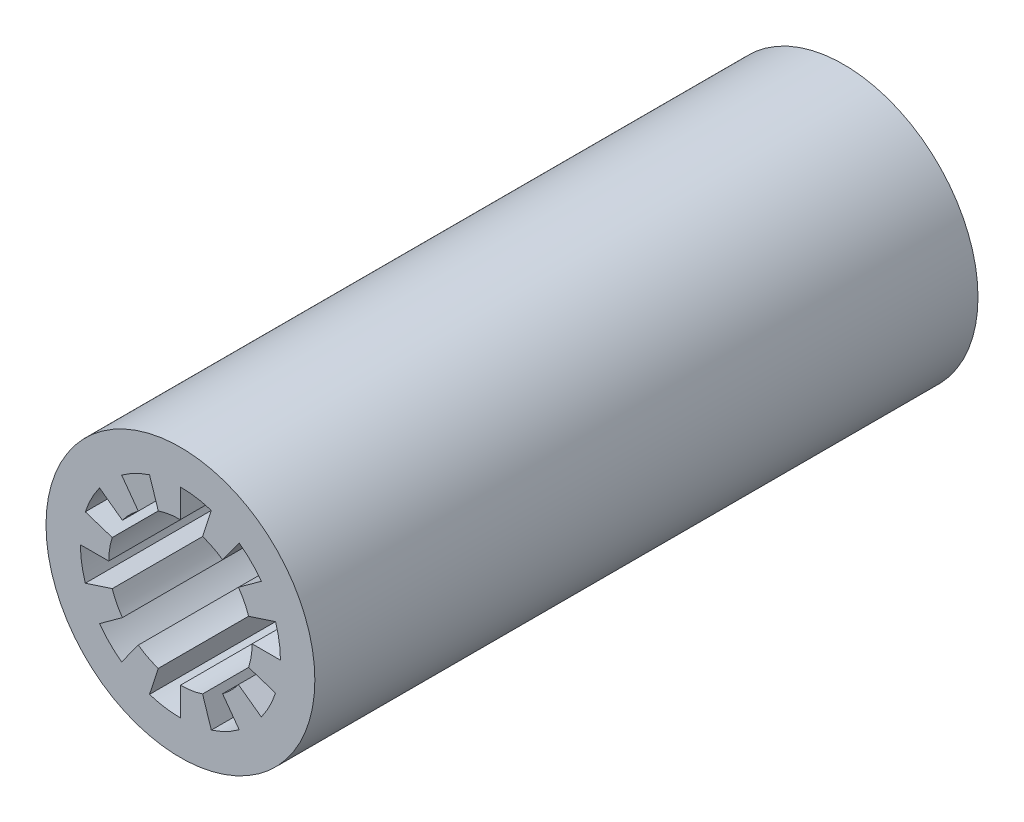
from build123d import *

# Parameters (mm, degrees)
SKETCH_1_R      = 7.5
EXTRUDE_1_DEPTH = 37


with BuildPart() as part:
    # Эскиз1 → Бобышка-Вытянуть1 (new body)
    with BuildSketch(Plane.XY):
        Circle(SKETCH_1_R)
        with BuildLine():
            Line((0, 5.579989869), (0, 4))
            ThreePointArc((0, 4), (-0.62573786, 3.950753362), (-1.236067977, 3.804226065))
            Line((-1.236067977, 3.804226065), (-1.724311698, 5.306885726))
            ThreePointArc((-1.724311698, 5.306885726), (-2.533262389, 4.971807378), (-3.279835753, 4.514306633))
            Line((-3.279835753, 4.514306633), (-2.351141009, 3.236067977))
            ThreePointArc((-2.351141009, 3.236067977), (-2.828427125, 2.828427125), (-3.236067977, 2.351141009))
            Line((-3.236067977, 2.351141009), (-4.514306633, 3.279835753))
            ThreePointArc((-4.514306633, 3.279835753), (-4.971807378, 2.533262389), (-5.306885726, 1.724311698))
            Line((-5.306885726, 1.724311698), (-3.804226065, 1.236067977))
            ThreePointArc((-3.804226065, 1.236067977), (-3.950753362, 0.62573786), (-4, 0))
            Line((-4, 0), (-5.579989869, 0))
            ThreePointArc((-5.579989869, 0), (-5.511290934, -0.87290273), (-5.306885726, -1.724311698))
            Line((-5.306885726, -1.724311698), (-3.804226065, -1.236067977))
            ThreePointArc((-3.804226065, -1.236067977), (-3.564026097, -1.815961999), (-3.236067977, -2.351141009))
            Line((-3.236067977, -2.351141009), (-4.514306633, -3.279835753))
            ThreePointArc((-4.514306633, -3.279835753), (-3.945648675, -3.945648675), (-3.279835753, -4.514306633))
            Line((-3.279835753, -4.514306633), (-2.351141009, -3.236067977))
            ThreePointArc((-2.351141009, -3.236067977), (-1.815961999, -3.564026097), (-1.236067977, -3.804226065))
            Line((-1.236067977, -3.804226065), (-1.724311698, -5.306885726))
            ThreePointArc((-1.724311698, -5.306885726), (-0.87290273, -5.511290934), (0, -5.579989869))
            Line((0, -5.579989869), (0, -4))
            ThreePointArc((0, -4), (0.62573786, -3.950753362), (1.236067977, -3.804226065))
            Line((1.236067977, -3.804226065), (1.724311698, -5.306885726))
            ThreePointArc((1.724311698, -5.306885726), (2.533262389, -4.971807378), (3.279835753, -4.514306633))
            Line((3.279835753, -4.514306633), (2.351141009, -3.236067977))
            ThreePointArc((2.351141009, -3.236067977), (2.828427125, -2.828427125), (3.236067977, -2.351141009))
            Line((3.236067977, -2.351141009), (4.514306633, -3.279835753))
            ThreePointArc((4.514306633, -3.279835753), (4.971807378, -2.533262389), (5.306885726, -1.724311698))
            Line((5.306885726, -1.724311698), (3.804226065, -1.236067977))
            ThreePointArc((3.804226065, -1.236067977), (3.950753362, -0.62573786), (4, 0))
            Line((4, 0), (5.579989869, 0))
            ThreePointArc((5.579989869, 0), (5.511290934, 0.87290273), (5.306885726, 1.724311698))
            Line((5.306885726, 1.724311698), (3.804226065, 1.236067977))
            ThreePointArc((3.804226065, 1.236067977), (3.564026097, 1.815961999), (3.236067977, 2.351141009))
            Line((3.236067977, 2.351141009), (4.514306633, 3.279835753))
            ThreePointArc((4.514306633, 3.279835753), (3.945648675, 3.945648675), (3.279835753, 4.514306633))
            Line((3.279835753, 4.514306633), (2.351141009, 3.236067977))
            ThreePointArc((2.351141009, 3.236067977), (1.815961999, 3.564026097), (1.236067977, 3.804226065))
            Line((1.236067977, 3.804226065), (1.724311698, 5.306885726))
            ThreePointArc((1.724311698, 5.306885726), (0.87290273, 5.511290934), (0, 5.579989869))
        make_face(mode=Mode.SUBTRACT)
    extrude(amount=EXTRUDE_1_DEPTH)


solid = part.part
